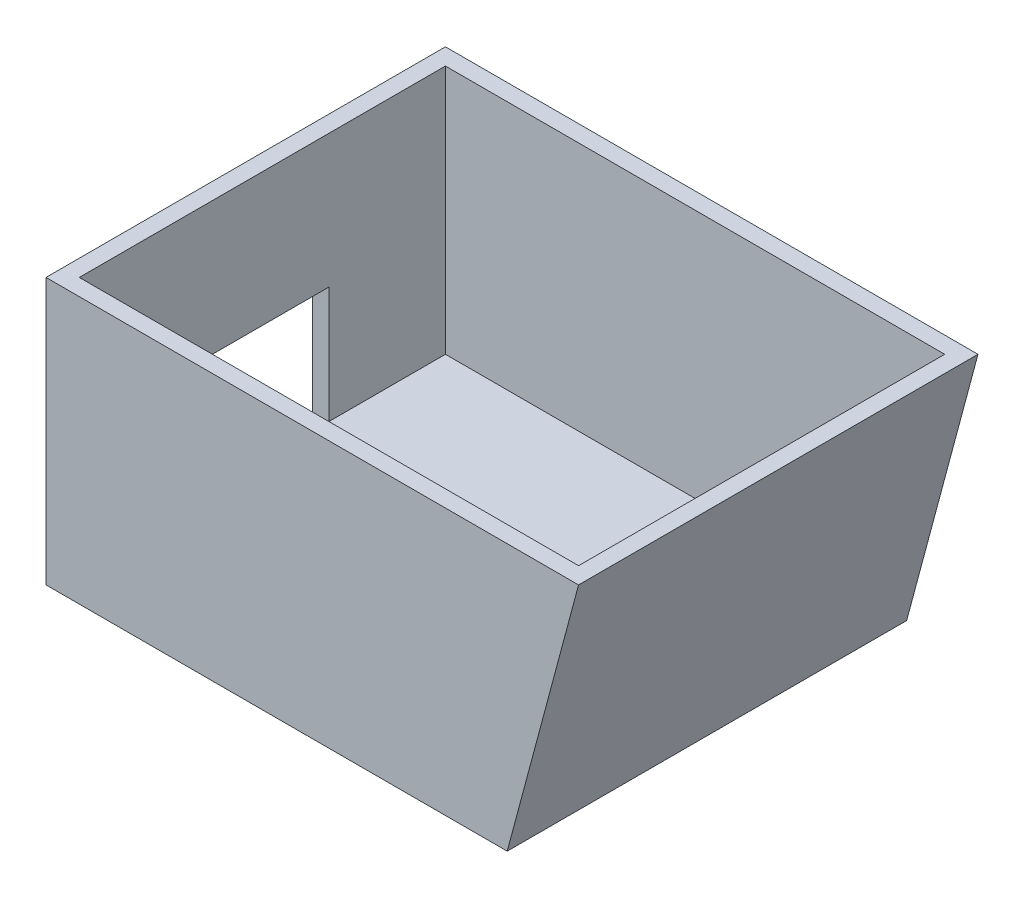
from build123d import *

# Parameters (mm, degrees)
SKETCH10_W                = 101.6
SKETCH10_H                = 76.2
BOSS_EXTRUDE4_DEPTH       = 50.8
F_6_CLEARANCE_HOLE1_D     = 3.7973
F_6_CLEARANCE_HOLE1_DEPTH = 12.7
F_6_CLEARANCE_HOLE1_TIP   = 1.140824014
CUT_EXTRUDE6_DEPTH        = 105.726882891
BOSS_EXTRUDE6_DEPTH       = 73.025
SKETCH19_W                = 95.25
SKETCH19_H                = 69.85
CUT_EXTRUDE7_DEPTH        = 47.625
BOSS_EXTRUDE7_DEPTH       = 73.025
SKETCH21_W                = 25.4
SKETCH21_H                = 25.4
CUT_EXTRUDE8_DEPTH        = 25.4


with BuildPart() as part:
    # Sketch10 → Boss-Extrude4 (new body)
    with BuildSketch(Plane(origin=(0, 0, 0), x_dir=(1, 0, 0), z_dir=(0, 1, 0))):
        Rectangle(SKETCH10_W, SKETCH10_H)
    extrude(amount=BOSS_EXTRUDE4_DEPTH)

    # #6 Clearance Hole1
    with Locations(Plane(origin=(0, 50.8, 0), x_dir=(1, 0, 0), z_dir=(0, 1, 0))):
        with Locations((44.45, 5.55625), (44.45, -5.55625)):
            Hole(F_6_CLEARANCE_HOLE1_D / 2, depth=F_6_CLEARANCE_HOLE1_DEPTH)
            with Locations((0, 0, -(F_6_CLEARANCE_HOLE1_DEPTH + F_6_CLEARANCE_HOLE1_TIP / 2))):  # 118° drill point
                Cone(0, F_6_CLEARANCE_HOLE1_D / 2, F_6_CLEARANCE_HOLE1_TIP, mode=Mode.SUBTRACT)

    # Sketch17 → Cut-Extrude6 (cut, through all)
    with BuildSketch(Plane.XY.offset(38.1)):
        Polygon((50.8, 0), (50.8, 50.8), (37.188181024, 0), align=None)
    extrude(amount=-CUT_EXTRUDE6_DEPTH, mode=Mode.SUBTRACT)

    # Sketch18 → Boss-Extrude6 (add)
    with BuildSketch(Plane.XY.offset(38.1)):
        Polygon((47.625, 50.8), (34.013181024, 0), (37.188181024, 0), (50.8, 50.8), align=None)
    extrude(amount=-BOSS_EXTRUDE6_DEPTH)

    # Sketch19 → Cut-Extrude7 (cut)
    with BuildSketch(Plane(origin=(0, 50.8, 0), x_dir=(1, 0, 0), z_dir=(0, 1, 0))):
        Rectangle(SKETCH19_W, SKETCH19_H)
    extrude(amount=-CUT_EXTRUDE7_DEPTH, mode=Mode.SUBTRACT)

    # Sketch20 → Boss-Extrude7 (add)
    with BuildSketch(Plane.XY.offset(38.1)):
        Polygon((47.625, 50.8), (34.013181024, 0), (37.188181024, 0), (50.8, 50.8), align=None)
    extrude(amount=-BOSS_EXTRUDE7_DEPTH)

    # Sketch21 → Cut-Extrude8 (cut)
    with BuildSketch(Plane.XZ):
        with Locations((-38.1, 0)):
            Rectangle(SKETCH21_W, SKETCH21_H)
    extrude(amount=-CUT_EXTRUDE8_DEPTH, mode=Mode.SUBTRACT)


solid = part.part
